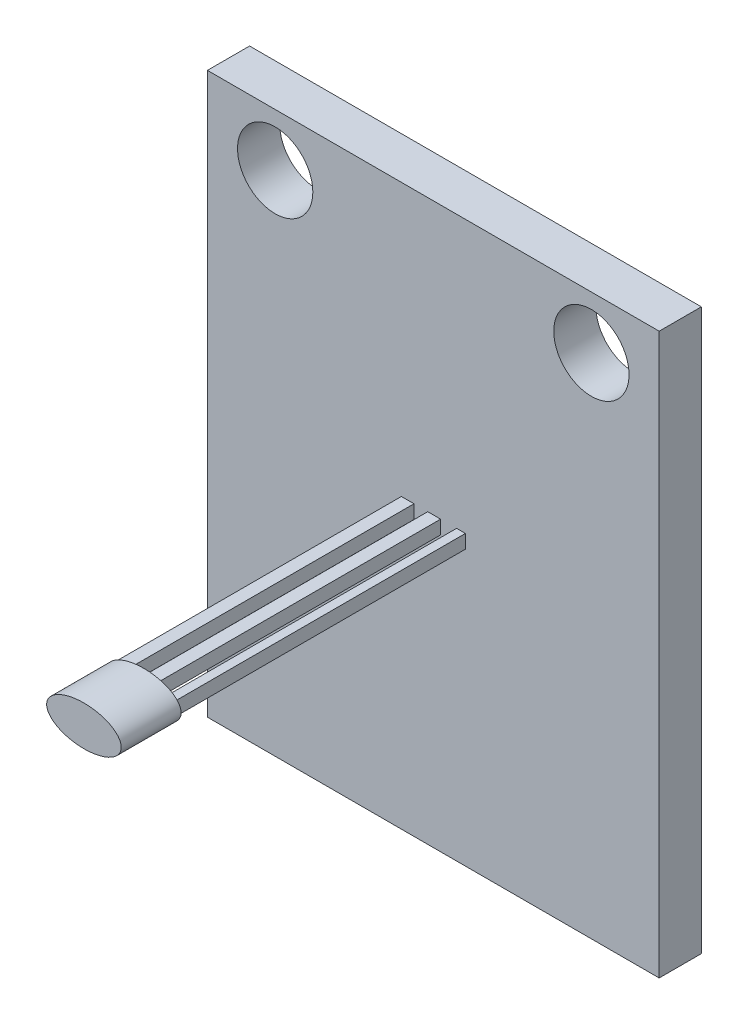
from build123d import *

# Parameters (mm, degrees)
SKETCH1_W           = 15
SKETCH1_H           = 18.6
SKETCH1_R           = 1.25
BOSS_EXTRUDE1_DEPTH = 1.4
SKETCH3_RX          = 1.238007016
SKETCH3_RY          = 0.65851437
BOSS_EXTRUDE2_DEPTH = 11.6
SKETCH4_W           = 0.456640639
SKETCH4_H           = 9.610469394
SKETCH4_W_2         = 0.530038758
SKETCH4_W_3         = 2.48112331
SKETCH4_W_4         = 2.853524762
CUT_EXTRUDE1_DEPTH  = 18.6
CUT_EXTRUDE2_REACH  = 29.202
SKETCH5_W           = 9.610469394
SKETCH5_H           = 4.489024126
SKETCH5_H_2         = 2.452224348


with BuildPart() as part:
    # Sketch1 → Boss-Extrude1 (new body)
    with BuildSketch(Plane.XY):
        with Locations((7.5, 9.3)):
            Rectangle(SKETCH1_W, SKETCH1_H)
        with Locations((2.25, 16.85)):
            Circle(SKETCH1_R, mode=Mode.SUBTRACT)
        with Locations(Location((12.75, 16.85, 0), (0, 0, 180))):
            Circle(SKETCH1_R, mode=Mode.SUBTRACT)
    extrude(amount=BOSS_EXTRUDE1_DEPTH)

    # Sketch3 → Boss-Extrude2 (add)
    with BuildSketch(Plane.XY.offset(1.4)):
        with Locations(Location((7.5, 9.3), (0, 0, 180))):
            Ellipse(SKETCH3_RX, SKETCH3_RY)
    extrude(amount=BOSS_EXTRUDE2_DEPTH)

    # Sketch4 → Cut-Extrude1 (cut)
    with BuildSketch(Plane.XZ):
        with Locations((7.087370884, 6.205234697)):
            Rectangle(SKETCH4_W, SKETCH4_H)
        with Locations((8.008203946, 6.205234697)):
            Rectangle(SKETCH4_W_2, SKETCH4_H)
        with Locations((5.200227297, 6.205234697)):
            Rectangle(SKETCH4_W_3, SKETCH4_H)
        with Locations((9.992974241, 6.205234697)):
            Rectangle(SKETCH4_W_4, SKETCH4_H)
    extrude(amount=-CUT_EXTRUDE1_DEPTH, mode=Mode.SUBTRACT)

    # Cut-Extrude2: up to this face of the body (flat: up to its plane)
    cut_extrude2_end = Plane(part.part.faces().sort_by_distance((15, 9.3, 0.7))[0])
    # Sketch5 → Cut-Extrude2 (cut, up to the picked face)
    with BuildSketch(Plane.ZY, mode=Mode.PRIVATE) as cut_extrude2_sk1:
        with Locations((6.205234697, 11.811177541)):
            Rectangle(SKETCH5_W, SKETCH5_H)
    cut_extrude2_tool1 = split(extrude(cut_extrude2_sk1.sketch, amount=-CUT_EXTRUDE2_REACH, mode=Mode.PRIVATE), bisect_by=cut_extrude2_end, keep=Keep.BOTH, mode=Mode.PRIVATE)
    # Sketch5 → Cut-Extrude2 (cut, up to the picked face)
    with BuildSketch(Plane.ZY, mode=Mode.PRIVATE) as cut_extrude2_sk2:
        with Locations((6.205234697, 7.887207935)):
            Rectangle(SKETCH5_W, SKETCH5_H_2)
    cut_extrude2_tool2 = split(extrude(cut_extrude2_sk2.sketch, amount=-CUT_EXTRUDE2_REACH, mode=Mode.PRIVATE), bisect_by=cut_extrude2_end, keep=Keep.BOTH, mode=Mode.PRIVATE)
    add(cut_extrude2_tool1.solids().sort_by(Axis((0, 11.811178, 6.205235), (1, 0, 0)))[0], mode=Mode.SUBTRACT)
    add(cut_extrude2_tool2.solids().sort_by(Axis((0, 7.887208, 6.205235), (1, 0, 0)))[0], mode=Mode.SUBTRACT)


solid = part.part
